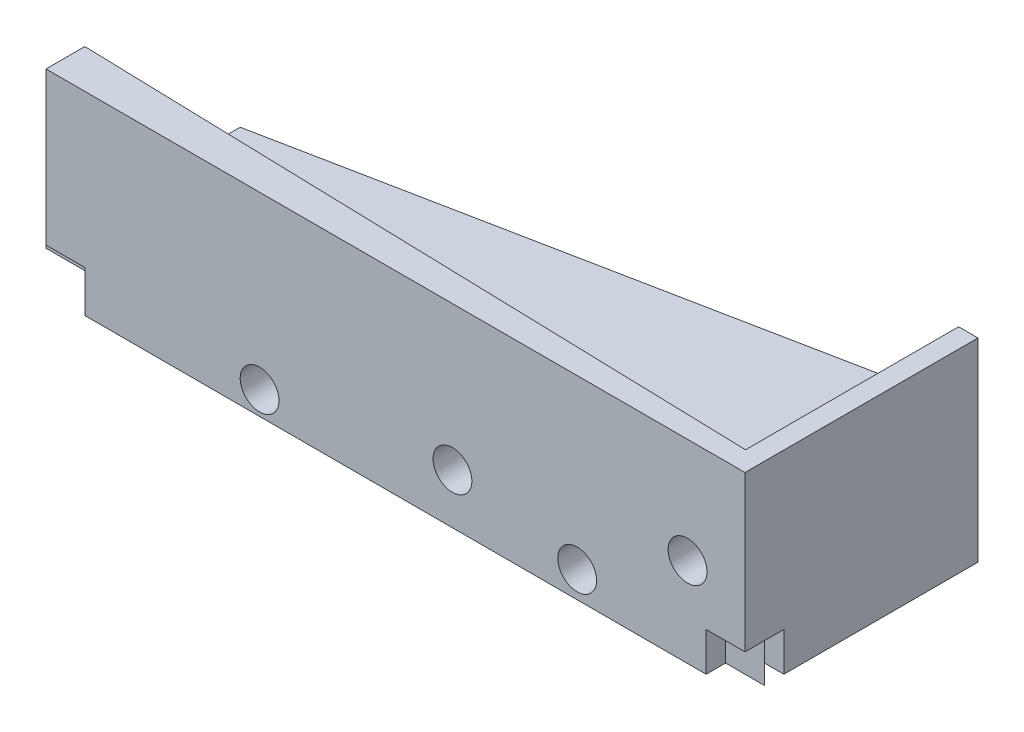
from build123d import *

# Parameters (mm, degrees)
ESQUISSE1_R             = 3
BOSS_EXTRU_1_DEPTH      = 200
ESQUISSE4_W             = 5
ESQUISSE4_H             = 50
BOSS_EXTRU_4_DEPTH      = 180
BOSS_EXTRU_7_DEPTH      = 50
ESQUISSE6_W             = 20
ESQUISSE6_H             = 10.719834163
ENL_V_MAT_EXTRU_2_DEPTH = 10
ESQUISSE5_W             = 10
ESQUISSE5_H             = 10
ENL_V_MAT_EXTRU_1_DEPTH = 10
ESQUISSE14_R            = 5
ENL_V_MAT_EXTRU_4_DEPTH = 15
BOSS_EXTRU_8_REACH      = 242.401
ENL_V_MAT_EXTRU_5_REACH = 238.046
ESQUISSE16_W            = 190
ESQUISSE16_H            = 150


with BuildPart() as part:
    # Esquisse1 → Boss.-Extru.1 (new body)
    with BuildSketch(Plane.XY):
        Polygon((-105.796013405, 0), (84.203986595, 0), (84.203986595, 33.502126335), (-105.796013405, 2), align=None)
        with Locations((69.406004871, 22.939397164)):
            Circle(ESQUISSE1_R, mode=Mode.SUBTRACT)
        with Locations((40.981469067, 6.77616521)):
            Circle(ESQUISSE1_R, mode=Mode.SUBTRACT)
        with Locations((-40.796013405, 6)):
            Circle(ESQUISSE1_R, mode=Mode.SUBTRACT)
        with Locations((8.861542866, 12.901085106)):
            Circle(ESQUISSE1_R, mode=Mode.SUBTRACT)
    extrude(amount=BOSS_EXTRU_1_DEPTH)

    # Esquisse4 → Boss.-Extru.4 (add)
    with BuildSketch(Plane(origin=(84.203986595, 0, 0), x_dir=(0, 0, -1), z_dir=(1, 0, 0))):
        with Locations((-202.5, 25)):
            Rectangle(ESQUISSE4_W, ESQUISSE4_H)
        with Locations((2.5, 25)):
            Rectangle(ESQUISSE4_W, ESQUISSE4_H)
    extrude(amount=-BOSS_EXTRU_4_DEPTH)

    # Esquisse8 → Boss.-Extru.7 (add)
    with BuildSketch(Plane(origin=(0, 50, 0), x_dir=(1, 0, 0), z_dir=(0, 1, 0))):
        Polygon((84.203986595, 0), (-95.796013405, 0), (-95.796013405, -5), align=None)
    boss_extru_7 = extrude(amount=-BOSS_EXTRU_7_DEPTH)

    # Esquisse6 → Enlèv. mat.-Extru.2 (cut)
    with BuildSketch(Plane(origin=(0, 0, -5), x_dir=(-1, 0, 0), z_dir=(0, 0, -1))):
        with Locations((95.796013405, 5.359917081)):
            Rectangle(ESQUISSE6_W, ESQUISSE6_H)
    enl_v_mat_extru_2 = extrude(amount=-ENL_V_MAT_EXTRU_2_DEPTH, mode=Mode.SUBTRACT)

    # Esquisse5 → Enlèv. mat.-Extru.1 (cut)
    with BuildSketch(Plane(origin=(84.203986595, 0, 0), x_dir=(0, 0, -1), z_dir=(1, 0, 0))):
        with Locations((-200, 5)):
            Rectangle(ESQUISSE5_W, ESQUISSE5_H)
        with Locations((0, 5)):
            Rectangle(ESQUISSE5_W, ESQUISSE5_H)
    extrude(amount=-ENL_V_MAT_EXTRU_1_DEPTH, mode=Mode.SUBTRACT)

    # Esquisse14 → Enlèv. mat.-Extru.4 (cut)
    with BuildSketch(Plane(origin=(0, 0, -5), x_dir=(-1, 0, 0), z_dir=(0, 0, -1))):
        with Locations((-69.406004871, 22.939397164)):
            Circle(ESQUISSE14_R)
        with Locations((-40.981469067, 6.77616521)):
            Circle(ESQUISSE14_R)
        with Locations((-8.861542866, 12.901085106)):
            Circle(ESQUISSE14_R)
        with Locations((40.796013405, 6)):
            Circle(ESQUISSE14_R)
    enl_v_mat_extru_4 = extrude(amount=-ENL_V_MAT_EXTRU_4_DEPTH, mode=Mode.SUBTRACT)

    # Symétrie3: Boss.-Extru.7, Enlèv. mat.-Extru.2, Enlèv. mat.-Extru.4 across plane
    add(boss_extru_7.mirror(Plane(origin=(0, 0, 100), x_dir=(1, 0, 0), z_dir=(0, 0, -1))))
    add(enl_v_mat_extru_2.mirror(Plane(origin=(0, 0, 100), x_dir=(1, 0, 0), z_dir=(0, 0, -1))), mode=Mode.SUBTRACT)
    add(enl_v_mat_extru_4.mirror(Plane(origin=(0, 0, 100), x_dir=(1, 0, 0), z_dir=(0, 0, -1))), mode=Mode.SUBTRACT)

    # Boss.-Extru.8: up to this plane
    boss_extru_8_end = Plane(origin=(-95.796013405, -180.069431054, 195), z_dir=(-0.0277670672403533, 0, 0.9996144206527183))
    # Esquisse15 → Boss.-Extru.8 (add, up to the surface)
    with BuildSketch(Plane(origin=(0, 0, -5), x_dir=(-1, 0, 0), z_dir=(0, 0, -1)), mode=Mode.PRIVATE) as boss_extru_8_sk1:
        Polygon((-84.203986595, 33.502126335), (-79.203986595, 32.67312301), (-79.203986595, 50), (-84.203986595, 50), align=None)
    boss_extru_8_tool1 = split(extrude(boss_extru_8_sk1.sketch, amount=-BOSS_EXTRU_8_REACH, mode=Mode.PRIVATE), bisect_by=boss_extru_8_end, keep=Keep.BOTH, mode=Mode.PRIVATE)
    add(boss_extru_8_tool1.solids().sort_by_distance((81.683563, 41.542119, -5))[0])

    # Enlèv. mat.-Extru.5: up to this face of the body (flat: up to its plane)
    enl_v_mat_extru_5_end = Plane(part.part.faces().sort_by_distance((-10.38578146, 0, 100.003530671))[0])
    # Esquisse16 → Enlèv. mat.-Extru.5 (cut, up to the picked face)
    with BuildSketch(Plane(origin=(0, 50, 0), x_dir=(1, 0, 0), z_dir=(0, 1, 0)), mode=Mode.PRIVATE) as enl_v_mat_extru_5_sk1:
        with Locations((-10.796013405, -70)):
            Rectangle(ESQUISSE16_W, ESQUISSE16_H)
    enl_v_mat_extru_5_tool1 = split(extrude(enl_v_mat_extru_5_sk1.sketch, amount=-ENL_V_MAT_EXTRU_5_REACH, mode=Mode.PRIVATE), bisect_by=enl_v_mat_extru_5_end, keep=Keep.BOTH, mode=Mode.PRIVATE)
    add(enl_v_mat_extru_5_tool1.solids().sort_by(Axis((-10.796013, 50, 70), (0, -1, 0)))[0], mode=Mode.SUBTRACT)


solid = part.part
